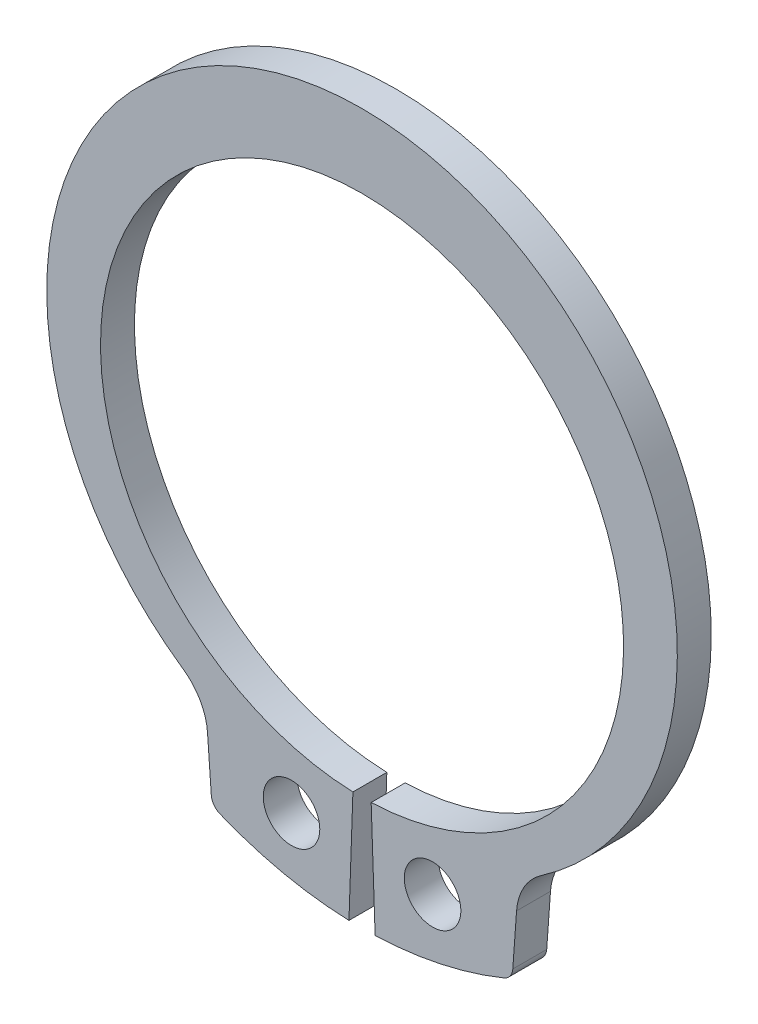
from build123d import *

# Parameters (mm, degrees)
SKETCH4_R           = 1
BOSS_EXTRUDE1_DEPTH = 0.6
FILLET1_R           = 2.013861721
FILLET2_R           = 0.50346543


with BuildPart() as part:
    # Sketch4 → Boss-Extrude1 (new, symmetric)
    with BuildSketch(Plane.XY):
        with BuildLine():
            Line((-5.309528497, -12.148477214), (-5.538454242, -8.97931092))
            ThreePointArc((-5.538454242, -8.97931092), (-10.776533172, 3.564464333), (0, 11.85))
            Line((0, 11.85), (0, 9.25))
            ThreePointArc((0, 9.25), (-9.24859118, 0.16143476), (-0.322820344, -9.24436515))
            Line((-0.322820344, -9.24436515), (-0.462700196, -13.25))
            ThreePointArc((-0.462700196, -13.25), (-2.938195727, -12.928402737), (-5.309528497, -12.148477214))
        make_face()
        with Locations((-2.49406972, -10.974196678)):
            Circle(SKETCH4_R, mode=Mode.SUBTRACT)
    extrude(amount=BOSS_EXTRUDE1_DEPTH, both=True)

    # Fillet1
    fillet1_edges = [part.edges().sort_by_distance(p)[0] for p in [
        (-5.538454242, -8.97931092, 0),
    ]]
    fillet(fillet1_edges, radius=FILLET1_R)

    # Fillet2
    fillet2_edges = [part.edges().sort_by_distance(p)[0] for p in [
        (-5.309528497, -12.148477214, 0),
    ]]
    fillet(fillet2_edges, radius=FILLET2_R)

    # Mirror1: part across plane


with BuildPart() as part_1:
    add(part.part)
    add(part.part.mirror(Plane(origin=(0, 11.85, 0.6), x_dir=(0, 0, 1), z_dir=(-1, 0, 0))))


solid = part_1.part
